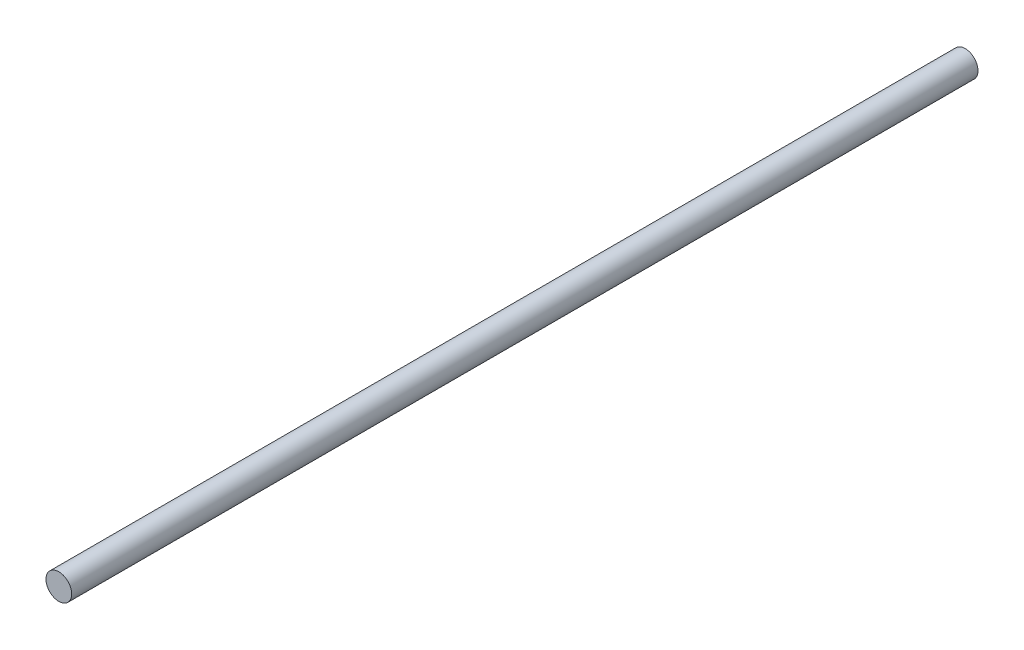
from build123d import *

# Parameters (mm, degrees)
SKETCH_1_R      = 4
EXTRUDE_1_DEPTH = 282


with BuildPart() as part:
    # Эскиз1 → Бобышка-Вытянуть1 (new body)
    with BuildSketch(Plane.XY):
        Circle(SKETCH_1_R)
    extrude(amount=EXTRUDE_1_DEPTH)


solid = part.part
